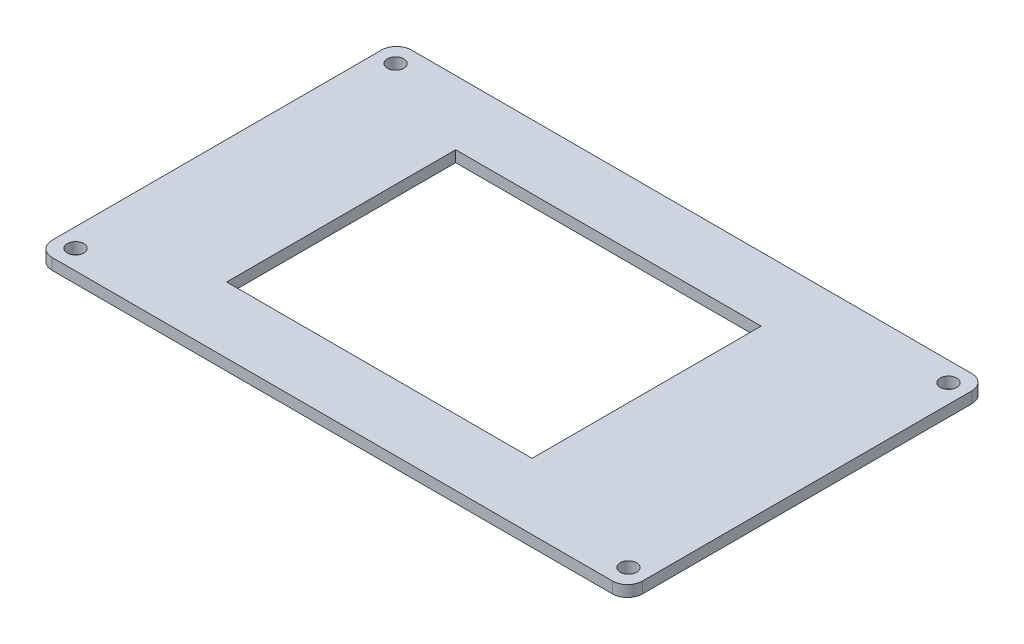
from build123d import *

# Parameters (mm, degrees)
SKETCH1_W           = 78.86
SKETCH1_H           = 48
SKETCH1_W_2         = 40.8
SKETCH1_H_2         = 30.6
BOSS_EXTRUDE1_DEPTH = 1.5
CUT_EXTRUDE1_REACH  = 48.184
SKETCH2_R           = 1.1
FILLET1_R           = 2


with BuildPart() as part:
    # Sketch1 → Boss-Extrude1 (new body)
    with BuildSketch(Plane(origin=(0, 0, 0), x_dir=(1, 0, 0), z_dir=(0, 1, 0))):
        Rectangle(SKETCH1_W, SKETCH1_H)
        with Locations((-2.54, 0.12)):
            Rectangle(SKETCH1_W_2, SKETCH1_H_2, mode=Mode.SUBTRACT)
    extrude(amount=BOSS_EXTRUDE1_DEPTH)

    # Sketch2 → Cut-Extrude1 (cut, up to next)
    with BuildSketch(Plane(origin=(0, 1.5, 0), x_dir=(1, 0, 0), z_dir=(0, 1, 0)), mode=Mode.PRIVATE) as cut_extrude1_sk1:
        with Locations(Location((-36.93, 21.375, 0), (0, 0, 270))):
            Circle(SKETCH2_R)
    cut_extrude1_tool1 = extrude(cut_extrude1_sk1.sketch, amount=-CUT_EXTRUDE1_REACH, mode=Mode.PRIVATE) & part.part
    # Sketch2 → Cut-Extrude1 (cut, up to next)
    with BuildSketch(Plane(origin=(0, 1.5, 0), x_dir=(1, 0, 0), z_dir=(0, 1, 0)), mode=Mode.PRIVATE) as cut_extrude1_sk2:
        with Locations(Location((-36.93, -21.375, 0), (0, 0, 270))):
            Circle(SKETCH2_R)
    cut_extrude1_tool2 = extrude(cut_extrude1_sk2.sketch, amount=-CUT_EXTRUDE1_REACH, mode=Mode.PRIVATE) & part.part
    # Sketch2 → Cut-Extrude1 (cut, up to next)
    with BuildSketch(Plane(origin=(0, 1.5, 0), x_dir=(1, 0, 0), z_dir=(0, 1, 0)), mode=Mode.PRIVATE) as cut_extrude1_sk3:
        with Locations(Location((36.93, 21.375, 0), (0, 0, 270))):
            Circle(SKETCH2_R)
    cut_extrude1_tool3 = extrude(cut_extrude1_sk3.sketch, amount=-CUT_EXTRUDE1_REACH, mode=Mode.PRIVATE) & part.part
    # Sketch2 → Cut-Extrude1 (cut, up to next)
    with BuildSketch(Plane(origin=(0, 1.5, 0), x_dir=(1, 0, 0), z_dir=(0, 1, 0)), mode=Mode.PRIVATE) as cut_extrude1_sk4:
        with Locations(Location((36.93, -21.375, 0), (0, 0, 270))):
            Circle(SKETCH2_R)
    cut_extrude1_tool4 = extrude(cut_extrude1_sk4.sketch, amount=-CUT_EXTRUDE1_REACH, mode=Mode.PRIVATE) & part.part
    add(cut_extrude1_tool1.solids().sort_by_distance((-36.93, 1.5, -21.375))[0], mode=Mode.SUBTRACT)
    add(cut_extrude1_tool2.solids().sort_by_distance((-36.93, 1.5, 21.375))[0], mode=Mode.SUBTRACT)
    add(cut_extrude1_tool3.solids().sort_by_distance((36.93, 1.5, -21.375))[0], mode=Mode.SUBTRACT)
    add(cut_extrude1_tool4.solids().sort_by_distance((36.93, 1.5, 21.375))[0], mode=Mode.SUBTRACT)

    # Fillet1
    fillet1_edges = [part.edges().sort_by_distance(p)[0] for p in [
        (-39.43, 0.75, -24),
        (39.43, 0.75, -24),
        (39.43, 0.75, 24),
        (-39.43, 0.75, 24),
    ]]
    fillet(fillet1_edges, radius=FILLET1_R)


solid = part.part
